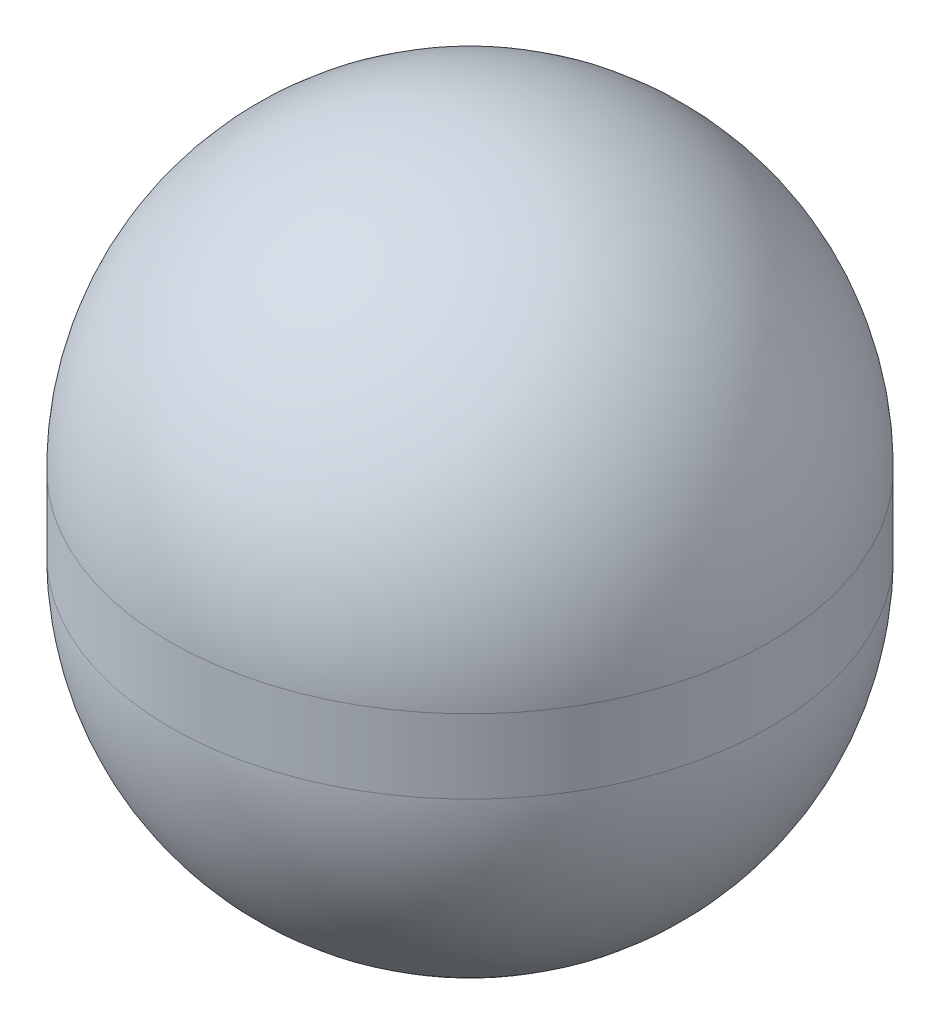
from build123d import *

# Parameters (mm, degrees)
REVOLVE1_ANGLE      = 180
SKETCH2_R           = 30.897972145
BOSS_EXTRUDE1_DEPTH = 7.62
REVOLVE2_ANGLE      = 180


with BuildPart() as part:
    # Sketch1 → Revolve1 (revolve)
    with BuildSketch(Plane(origin=(0, 0, 0), x_dir=(1, 0, 0), z_dir=(0, 1, 0))):
        with BuildLine():
            Line((0, -30.897972145), (0, 30.897972145))
            ThreePointArc((0, 30.897972145), (30.897972145, 0), (0, -30.897972145))
        make_face()
    revolve(axis=Axis((0, 0, 30.897972145), (0, 0, -1)), revolution_arc=REVOLVE1_ANGLE)

    # Sketch2 → Boss-Extrude1 (add)
    with BuildSketch(Plane(origin=(0, 0, 0), x_dir=(1, 0, 0), z_dir=(0, 1, 0))):
        Circle(SKETCH2_R)
    extrude(amount=BOSS_EXTRUDE1_DEPTH)

    # Sketch3 → Revolve2 (revolve)
    with BuildSketch(Plane(origin=(0, 7.62, 0), x_dir=(1, 0, 0), z_dir=(0, 1, 0))):
        with BuildLine():
            Line((0, 30.897972145), (0, -30.897972145))
            ThreePointArc((0, -30.897972145), (30.897972145, 0), (0, 30.897972145))
        make_face()
    revolve(axis=Axis((0, 7.62, -30.897972145), (0, 0, 1)), revolution_arc=REVOLVE2_ANGLE)


solid = part.part
